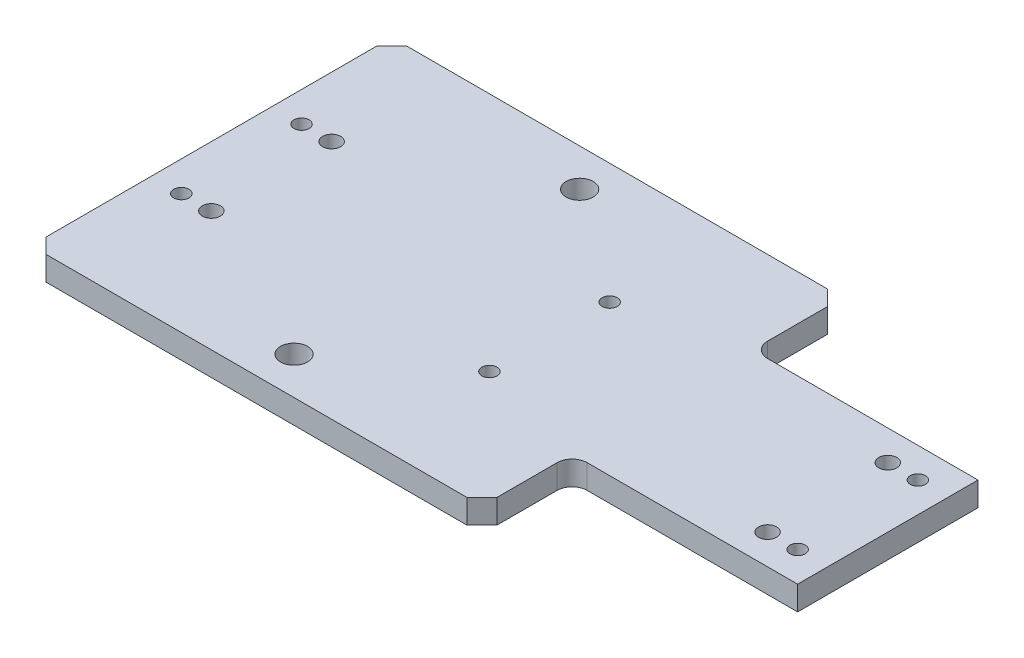
from build123d import *

# Parameters (mm, degrees)
EXTRUDE_1_DEPTH          = 16
CUT_EXTRUDE_1_DEPTH      = 256.501467706
CUT_EXTRUDE_1_DEPTH_BACK = 256.501467706
SKETCH_2_R               = 9
CUT_EXTRUDE_2_DEPTH      = 256.501467706
CUT_EXTRUDE_2_DEPTH_BACK = 256.501467706
SKETCH_3_R               = 6
CUT_EXTRUDE_3_DEPTH      = 256.501467706
CUT_EXTRUDE_3_DEPTH_BACK = 256.501467706
SKETCH_4_R               = 5.053


with BuildPart() as part:
    # ｽｹｯﾁ1 → ﾎﾞｽ - 押し出し1 (new body)
    with BuildSketch(Plane(origin=(0, 0, 0), x_dir=(1, 0, 0), z_dir=(0, 1, 0))):
        with BuildLine():
            Line((-215, -120), (65, -120))
            Line((65, -120), (75, -110))
            Line((75, -110), (75, -70))
            ThreePointArc((75, -70), (77.928932188, -62.928932188), (85, -60))
            Line((85, -60), (225, -60))
            Line((225, -60), (225, 60))
            Line((225, 60), (85, 60))
            ThreePointArc((85, 60), (77.928932188, 62.928932188), (75, 70))
            Line((75, 70), (75, 110))
            Line((75, 110), (65, 120))
            Line((65, 120), (-215, 120))
            Line((-215, 120), (-225, 110))
            Line((-225, 110), (-225, -110))
            Line((-225, -110), (-215, -120))
        make_face()
    extrude(amount=EXTRUDE_1_DEPTH)

    # ｽｹｯﾁ2 → ｶｯﾄ - 押し出し1 (cut, two sides: drawn at the far end of the back side and taken through both)
    with BuildSketch(Plane(origin=(0, 0, 0), x_dir=(1, 0, 0), z_dir=(0, 1, 0)).offset(-CUT_EXTRUDE_1_DEPTH_BACK)):
        with Locations(Location((-75, -95, 0), (0, 0, 270))):
            Circle(SKETCH_2_R)
        with Locations(Location((-75, 95, 0), (0, 0, 270))):
            Circle(SKETCH_2_R)
    extrude(amount=CUT_EXTRUDE_1_DEPTH + CUT_EXTRUDE_1_DEPTH_BACK, mode=Mode.SUBTRACT)

    # ｽｹｯﾁ3 → ｶｯﾄ - 押し出し2 (cut, two sides: drawn at the far end of the back side and taken through both)
    with BuildSketch(Plane(origin=(0, 0, 0), x_dir=(1, 0, 0), z_dir=(0, 1, 0)).offset(-CUT_EXTRUDE_2_DEPTH_BACK)):
        with Locations(Location((-185, -40, 0), (0, 0, 270))):
            Circle(SKETCH_3_R)
        with Locations(Location((-185, 40, 0), (0, 0, 270))):
            Circle(SKETCH_3_R)
        with Locations(Location((185, -40, 0), (0, 0, 270))):
            Circle(SKETCH_3_R)
        with Locations(Location((185, 40, 0), (0, 0, 270))):
            Circle(SKETCH_3_R)
    extrude(amount=CUT_EXTRUDE_2_DEPTH + CUT_EXTRUDE_2_DEPTH_BACK, mode=Mode.SUBTRACT)

    # ｽｹｯﾁ4 → ｶｯﾄ - 押し出し3 (cut, two sides: drawn at the far end of the back side and taken through both)
    with BuildSketch(Plane(origin=(0, 0, 0), x_dir=(1, 0, 0), z_dir=(0, 1, 0)).offset(-CUT_EXTRUDE_3_DEPTH_BACK)):
        with Locations(Location((-205, -40, 0), (0, 0, 270))):
            Circle(SKETCH_4_R)
        with Locations(Location((-205, 40, 0), (0, 0, 270))):
            Circle(SKETCH_4_R)
        with Locations(Location((0, -40, 0), (0, 0, 270))):
            Circle(SKETCH_4_R)
        with Locations(Location((0, 40, 0), (0, 0, 270))):
            Circle(SKETCH_4_R)
        with Locations(Location((205, -40, 0), (0, 0, 270))):
            Circle(SKETCH_4_R)
        with Locations(Location((205, 40, 0), (0, 0, 270))):
            Circle(SKETCH_4_R)
    extrude(amount=CUT_EXTRUDE_3_DEPTH + CUT_EXTRUDE_3_DEPTH_BACK, mode=Mode.SUBTRACT)


solid = part.part
